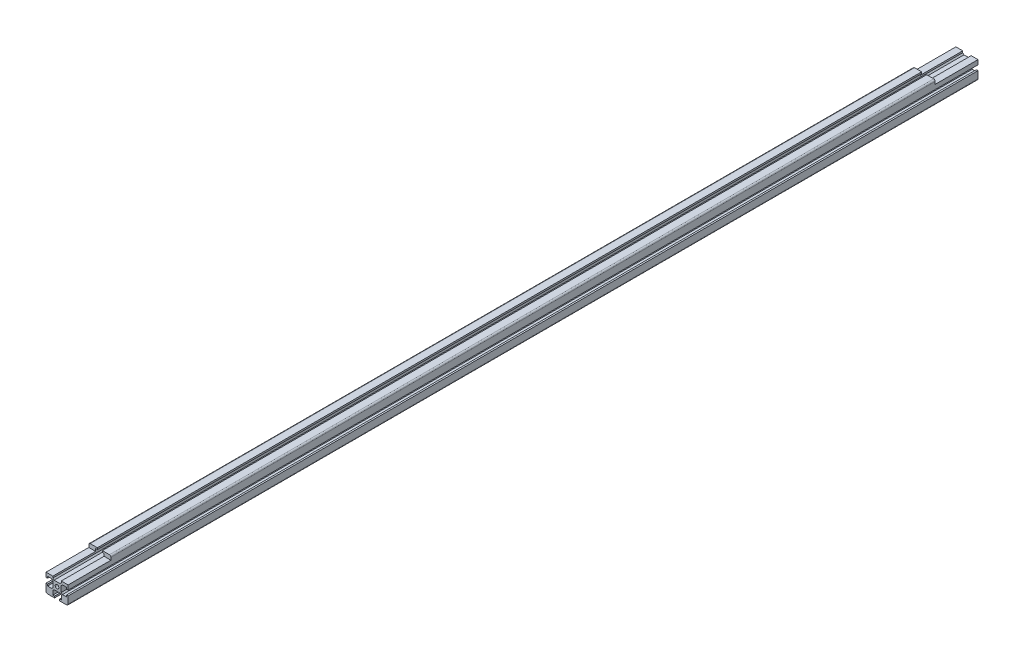
from build123d import *

# Parameters (mm, degrees)
SKETCH1_R           = 1.25
BOSS_EXTRUDE1_DEPTH = 616.81
FILLET1_R           = 1
SKETCH2_W           = 15
SKETCH2_H           = 29.01
CUT_EXTRUDE2_DEPTH  = 2.74
SKETCH3_W           = 15
SKETCH3_H           = 29.01
CUT_EXTRUDE3_DEPTH  = 2.74


with BuildPart() as part:
    # Sketch1 → Boss-Extrude1 (new body)
    with BuildSketch(Plane.XY):
        Polygon((7.5, -7.5), (1.7, -7.5), (1.7, -6.4), (2.85, -6.4), (2.85, -3.63183498), (2.01816502, -2.8), (-2.01816502, -2.8), (-2.85, -3.63183498), (-2.85, -6.4), (-1.7, -6.4), (-1.7, -7.5), (-7.5, -7.5), (-7.5, -1.7), (-6.4, -1.7), (-6.4, -2.85), (-3.63183498, -2.85), (-2.8, -2.01816502), (-2.8, 2.01816502), (-3.63183498, 2.85), (-6.4, 2.85), (-6.4, 1.7), (-7.5, 1.7), (-7.5, 7.5), (-1.7, 7.5), (-1.7, 6.4), (-2.85, 6.4), (-2.85, 3.63183498), (-2.01816502, 2.8), (2.01816502, 2.8), (2.85, 3.63183498), (2.85, 6.4), (1.7, 6.4), (1.7, 7.5), (7.5, 7.5), (7.5, 1.7), (6.4, 1.7), (6.4, 2.85), (3.63183498, 2.85), (2.8, 2.01816502), (2.8, -2.01816502), (3.63183498, -2.85), (6.4, -2.85), (6.4, -1.7), (7.5, -1.7), align=None)
        Circle(SKETCH1_R, mode=Mode.SUBTRACT)
    extrude(amount=BOSS_EXTRUDE1_DEPTH)

    # Fillet1
    fillet1_edges = [part.edges().sort_by_distance(p)[0] for p in [
        (-7.5, 7.5, 308.405),
        (7.5, 7.5, 308.405),
        (7.5, -7.5, 308.405),
        (-7.5, -7.5, 308.405),
    ]]
    fillet(fillet1_edges, radius=FILLET1_R)

    # Sketch2 → Cut-Extrude2 (cut)
    with BuildSketch(Plane(origin=(0, 7.5, 0), x_dir=(1, 0, 0), z_dir=(0, 1, 0))):
        with Locations((0, -602.305)):
            Rectangle(SKETCH2_W, SKETCH2_H)
    extrude(amount=-CUT_EXTRUDE2_DEPTH, mode=Mode.SUBTRACT)

    # Sketch3 → Cut-Extrude3 (cut)
    with BuildSketch(Plane(origin=(0, 7.5, 0), x_dir=(1, 0, 0), z_dir=(0, 1, 0))):
        with Locations((0, -14.505)):
            Rectangle(SKETCH3_W, SKETCH3_H)
    extrude(amount=-CUT_EXTRUDE3_DEPTH, mode=Mode.SUBTRACT)


solid = part.part
